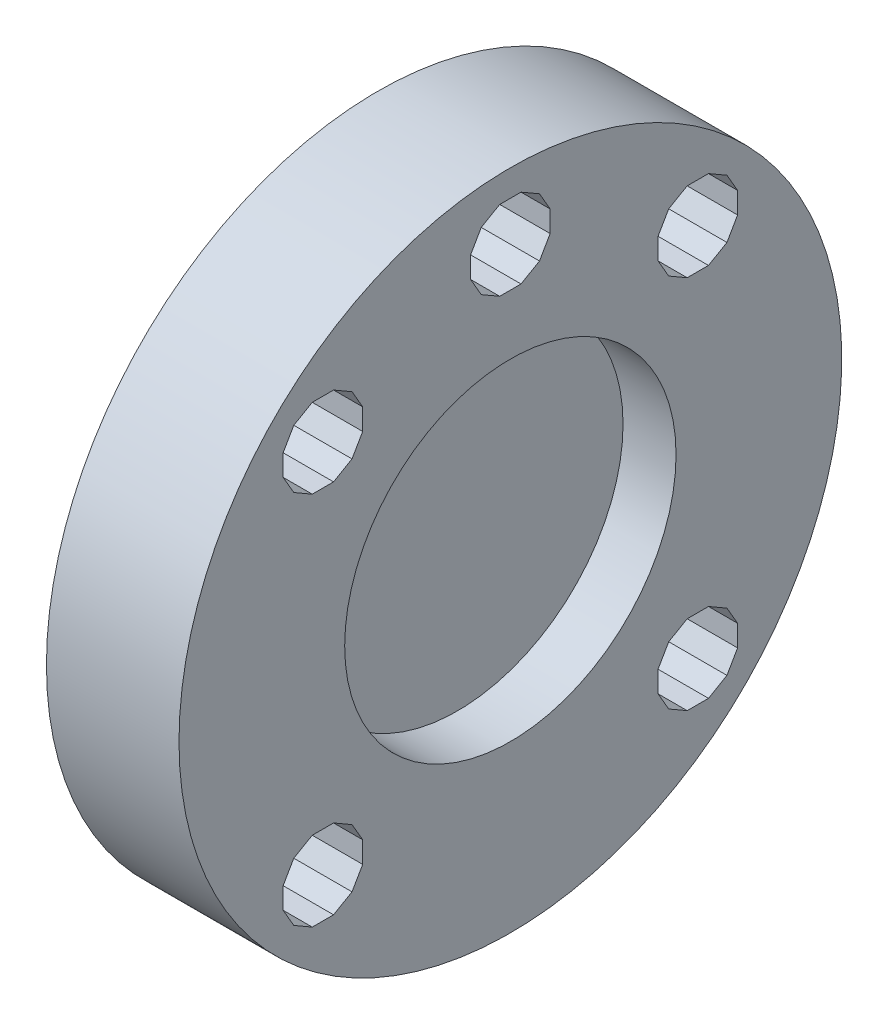
from build123d import *

# Parameters (mm, degrees)
SKETCH1_W                      = 10
SKETCH1_H                      = 25
CUT_EXTRUDE1_DEPTH             = 37.742346142
CUT_EXTRUDE2_DEPTH             = 37.742346142
CUT_EXTRUDE3_DEPTH             = 37.742346142
CUT_EXTRUDE4_DEPTH             = 37.742346142
CUT_EXTRUDE5_DEPTH             = 37.742346142
BOSS_EXTRUDE1_DEPTH            = 1.5
F_25_0_25_DIAMETER_HOLE1_D     = 25
F_25_0_25_DIAMETER_HOLE1_DEPTH = 4


with BuildPart() as part:
    # Sketch1 → Revolve1 (revolve)
    with BuildSketch(Plane(origin=(0, 0, 0), x_dir=(-1, 0, 0), z_dir=(0, 0, -1))):
        with Locations((0, 12.5)):
            Rectangle(SKETCH1_W, SKETCH1_H)
    revolve(axis=Axis((5, 0, 0), (-1, 0, 0)))

    # Sketch2 → Cut-Extrude1 (cut, through all)
    with BuildSketch(Plane.ZY.offset(5)):
        Polygon((0.803847577, 17), (2.196152423, 17.803847577), (3, 19.196152423), (3, 20.803847577), (2.196152423, 22.196152423), (0.803847577, 23), (-0.803847577, 23), (-2.196152423, 22.196152423), (-3, 20.803847577), (-3, 19.196152423), (-2.196152423, 17.803847577), (-0.803847577, 17), align=None)
    extrude(amount=-CUT_EXTRUDE1_DEPTH, mode=Mode.SUBTRACT)

    # Sketch3 → Cut-Extrude2 (cut, through all)
    with BuildSketch(Plane.ZY.offset(5)):
        Polygon((-13.338288046, -17.142135624), (-11.945983201, -16.338288046), (-11.142135624, -14.945983201), (-11.142135624, -13.338288046), (-11.945983201, -11.945983201), (-13.338288046, -11.142135624), (-14.945983201, -11.142135624), (-16.338288046, -11.945983201), (-17.142135624, -13.338288046), (-17.142135624, -14.945983201), (-16.338288046, -16.338288046), (-14.945983201, -17.142135624), align=None)
    extrude(amount=-CUT_EXTRUDE2_DEPTH, mode=Mode.SUBTRACT)

    # Sketch4 → Cut-Extrude3 (cut, through all)
    with BuildSketch(Plane.ZY.offset(5)):
        Polygon((14.945983201, -17.142135624), (16.338288046, -16.338288046), (17.142135624, -14.945983201), (17.142135624, -13.338288046), (16.338288046, -11.945983201), (14.945983201, -11.142135624), (13.338288046, -11.142135624), (11.945983201, -11.945983201), (11.142135624, -13.338288046), (11.142135624, -14.945983201), (11.945983201, -16.338288046), (13.338288046, -17.142135624), align=None)
    extrude(amount=-CUT_EXTRUDE3_DEPTH, mode=Mode.SUBTRACT)

    # Sketch5 → Cut-Extrude4 (cut, through all)
    with BuildSketch(Plane.ZY.offset(5)):
        Polygon((16.338288046, 11.945983201), (17.142135624, 13.338288046), (17.142135624, 14.945983201), (16.338288046, 16.338288046), (14.945983201, 17.142135624), (13.338288046, 17.142135624), (11.945983201, 16.338288046), (11.142135624, 14.945983201), (11.142135624, 13.338288046), (11.945983201, 11.945983201), (13.338288046, 11.142135624), (14.945983201, 11.142135624), align=None)
    extrude(amount=-CUT_EXTRUDE4_DEPTH, mode=Mode.SUBTRACT)

    # Sketch6 → Cut-Extrude5 (cut, through all)
    with BuildSketch(Plane(origin=(5, 0, 0), x_dir=(0, 0, -1), z_dir=(1, 0, 0))):
        Polygon((16.338288046, 11.945983201), (17.142135624, 13.338288046), (17.142135624, 14.945983201), (16.338288046, 16.338288046), (14.945983201, 17.142135624), (13.338288046, 17.142135624), (11.945983201, 16.338288046), (11.142135624, 14.945983201), (11.142135624, 13.338288046), (11.945983201, 11.945983201), (13.338288046, 11.142135624), (14.945983201, 11.142135624), align=None)
    extrude(amount=-CUT_EXTRUDE5_DEPTH, mode=Mode.SUBTRACT)

    # Sketch7 → Boss-Extrude1 (add)
    with BuildSketch(Plane.ZY.offset(5)):
        Polygon((8.233090996, -8.233090996), (5.285969807, -10.374299875), (1.821421064, -11.5), (-1.821421064, -11.5), (-5.285969807, -10.374299875), (-8.233090996, -8.233090996), (-10.374299875, -5.285969807), (-11.5, -1.821421064), (-11.5, 1.821421064), (-10.374299875, 5.285969807), (-8.233090996, 8.233090996), (-5.285969807, 10.374299875), (-1.821421064, 11.5), (1.821421064, 11.5), (5.285969807, 10.374299875), (8.233090996, 8.233090996), (10.374299875, 5.285969807), (11.5, 1.821421064), (11.5, -1.821421064), (10.374299875, -5.285969807), align=None)
    extrude(amount=BOSS_EXTRUDE1_DEPTH)

    # Ø25.0 (25) Diameter Hole1
    with Locations(Plane(origin=(5, 0, 0), x_dir=(0, 0, -1), z_dir=(1, 0, 0))):
        with Locations((0, 0)):
            Hole(F_25_0_25_DIAMETER_HOLE1_D / 2, depth=F_25_0_25_DIAMETER_HOLE1_DEPTH)


solid = part.part
